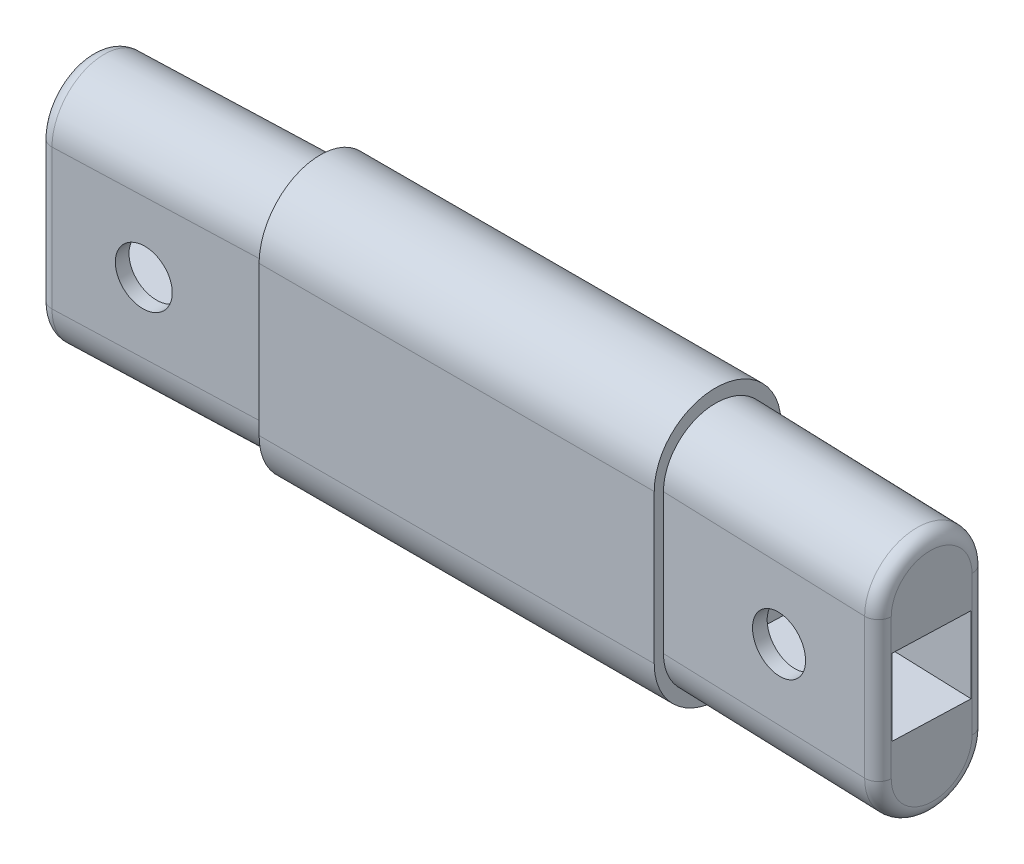
from build123d import *

# Parameters (mm, degrees)
CENTER_DEPTH         = 23
CENTER_DEPTH_BACK    = 23
ANGLE_CUT_DEPTH      = 29.472794032
ANGLE_CUT_DEPTH_BACK = 29.472794032
END_DEPTH            = 25
FILLET2_R            = 1.5
SKETCH10_W           = 8.6
SKETCH10_H           = 8.6
SQUARE_HOLE_DEPTH    = 18.6
ROUND_HOLE_REACH     = 53.623
SKETCH11_R           = 3.1
FILLET2_OF_MIRROR2_R = 1.5


with BuildPart() as part:
    # Sketch1 → Center (new, two sides: drawn at the far end of the back side and taken through both)
    with BuildSketch(Plane.ZY.offset(-CENTER_DEPTH_BACK)):
        with BuildLine():
            Line((6.9, 8.4), (6.9, -8.4))
            ThreePointArc((6.9, -8.4), (0, -15.3), (-6.9, -8.4))
            Line((-6.9, -8.4), (-6.9, 8.4))
            ThreePointArc((-6.9, 8.4), (0, 15.3), (6.9, 8.4))
        make_face()
    extrude(amount=CENTER_DEPTH + CENTER_DEPTH_BACK)

    # Sketch8 → Angle Cut (cut, two sides: drawn at the far end of the back side and taken through both)
    with BuildSketch(Plane(origin=(0, 0, 0), x_dir=(1, 0, 0), z_dir=(0, 1, 0)).offset(-ANGLE_CUT_DEPTH_BACK)):
        Polygon((-32.849207695, 10), (-22.849207695, 10), (-22.150792305, -10), (-32.849207695, -10), align=None)
        Polygon((32.849207695, -10), (22.150792305, -10), (22.849207695, 10), (32.849207695, 10), align=None)
    extrude(amount=ANGLE_CUT_DEPTH + ANGLE_CUT_DEPTH_BACK, mode=Mode.SUBTRACT)

    # Sketch9 → End (add)
    with BuildSketch(Plane(origin=(22.472595565, 0, 0.78476033), x_dir=(0.03489949670249425, 0, -0.999390827019096), z_dir=(0.999390827019096, 0, 0.03489949670249425))):
        with BuildLine():
            Line((-5.114761324, -7.9), (-5.114761324, 7.9))
            ThreePointArc((-5.114761324, 7.9), (0.785238676, 13.8), (6.685238676, 7.9))
            Line((6.685238676, 7.9), (6.685238676, -7.9))
            ThreePointArc((6.685238676, -7.9), (0.785238676, -13.8), (-5.114761324, -7.9))
        make_face()
    end = extrude(amount=END_DEPTH)

    # Fillet2
    fillet2_edges = [part.edges().sort_by_distance(p)[0] for p in [
        (47.278863645, 0, 6.768893297),
        (47.484770675, 13.8, 0.872487418),
        (47.690677706, 0, -5.023918462),
        (47.484770675, -13.8, 0.872487418),
    ]]
    fillet(fillet2_edges, radius=FILLET2_R)

    # Sketch10 → Square Hole (cut)
    with BuildSketch(Plane(origin=(47.457366241, 0, 1.657247747), x_dir=(0.03489949670249425, 0, -0.999390827019096), z_dir=(0.999390827019096, 0, 0.03489949670249425))):
        with Locations((0.785238676, 0)):
            Rectangle(SKETCH10_W, SKETCH10_H)
    square_hole = extrude(amount=-SQUARE_HOLE_DEPTH, mode=Mode.SUBTRACT)

    # Sketch11 → Round Hole (cut, up to next)
    with BuildSketch(Plane(origin=(-0.178502596, 0, 5.11164555), x_dir=(0.999390827019096, 0, 0.03489949670249425), z_dir=(-0.03489949670249425, 0, 0.999390827019096)), mode=Mode.PRIVATE) as round_hole_sk1:
        with Locations((35.986293608, 0)):
            Circle(SKETCH11_R)
    round_hole_tool1 = extrude(round_hole_sk1.sketch, amount=-ROUND_HOLE_REACH, mode=Mode.PRIVATE) & part.part
    round_hole = round_hole_tool1.solids().sort_by_distance((35.785869, 0, 6.367549))[0]
    add(round_hole, mode=Mode.SUBTRACT)

    # Mirror2: End, Square Hole, Round Hole across plane
    add(end.mirror(Plane(origin=(0, 0, 0), x_dir=(0, 0, 1), z_dir=(1, 0, 0))))
    add(square_hole.mirror(Plane(origin=(0, 0, 0), x_dir=(0, 0, 1), z_dir=(1, 0, 0))), mode=Mode.SUBTRACT)
    add(round_hole.mirror(Plane(origin=(0, 0, 0), x_dir=(0, 0, 1), z_dir=(1, 0, 0))), mode=Mode.SUBTRACT)

    # Fillet2 of Mirror2
    fillet2_of_mirror2_edges = [part.edges().sort_by_distance(p)[0] for p in [
        (-47.278863645, 0, 6.768893297),
        (-47.484770675, 13.8, 0.872487418),
        (-47.690677706, 0, -5.023918462),
        (-47.484770675, -13.8, 0.872487418),
    ]]
    fillet(fillet2_of_mirror2_edges, radius=FILLET2_OF_MIRROR2_R)


solid = part.part
